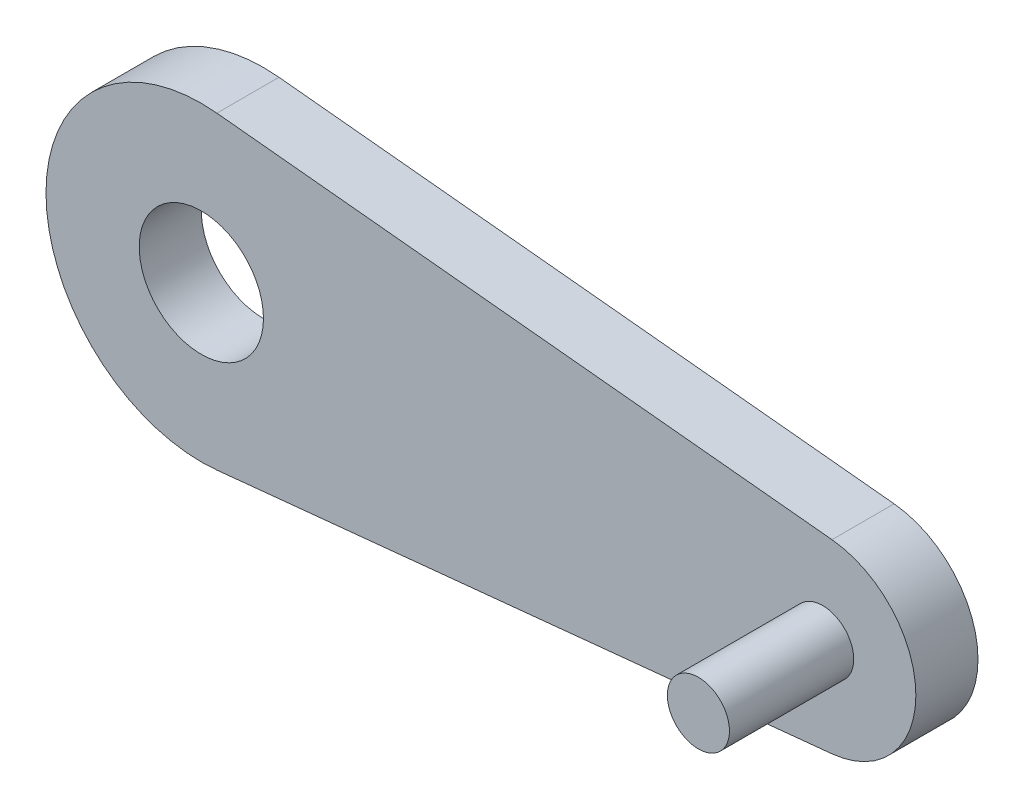
from build123d import *

# Parameters (mm, degrees)
SKETCH_1_R      = 1
EXTRUDE_1_DEPTH = 1
SKETCH_2_R      = 0.5
EXTRUDE_2_DEPTH = 2


with BuildPart() as part:
    # 草图1 → 凸台-拉伸1 (new body)
    with BuildSketch(Plane.XY):
        with BuildLine():
            Line((0.25, 2.487468593), (10.15, 1.492481156))
            ThreePointArc((10.15, 1.492481156), (11.5, 0), (10.15, -1.492481156))
            Line((10.15, -1.492481156), (0.25, -2.487468593))
            ThreePointArc((0.25, -2.487468593), (-2.5, 0), (0.25, 2.487468593))
        make_face()
        Circle(SKETCH_1_R, mode=Mode.SUBTRACT)
    extrude(amount=EXTRUDE_1_DEPTH)

    # 草图2 → 凸台-拉伸2 (add)
    with BuildSketch(Plane.XY.offset(1)):
        with Locations((10, 0)):
            Circle(SKETCH_2_R)
    extrude(amount=EXTRUDE_2_DEPTH)


solid = part.part
